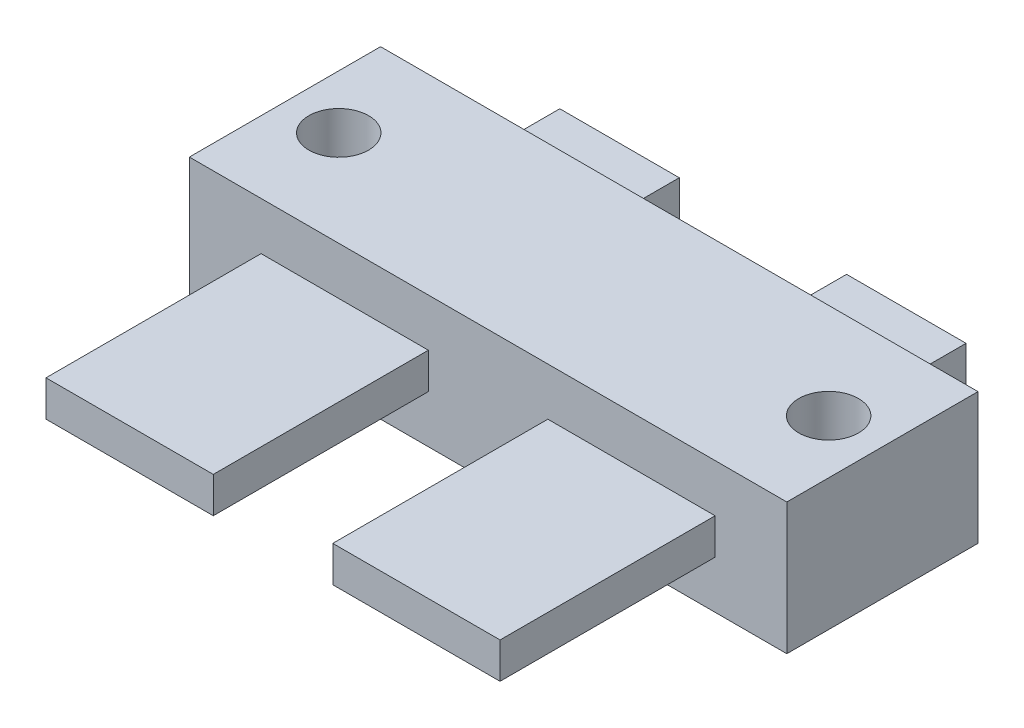
from build123d import *

# Parameters (mm, degrees)
SKETCH_1_W          = 25
SKETCH_1_H          = 8
EXTRUDE_1_DEPTH     = 5.5
SKETCH_3_W          = 7
SKETCH_3_H          = 1.5
EXTRUDE_3_DEPTH     = 9
SKETCH_4_W          = 5
SKETCH_4_H          = 1.5
EXTRUDE_4_DEPTH     = 3.5
SKETCH_5_R          = 1.25
CUT_EXTRUDE_1_DEPTH = 2


with BuildPart() as part:
    # 草图1 → 凸台-拉伸1 (new body)
    with BuildSketch(Plane(origin=(0, 0, 0), x_dir=(1, 0, 0), z_dir=(0, 1, 0))):
        Rectangle(SKETCH_1_W, SKETCH_1_H)
    extrude(amount=EXTRUDE_1_DEPTH)

    # 草图3 → 凸台-拉伸3 (add)
    with BuildSketch(Plane.XY.offset(4)):
        with Locations((-6, 2.75)):
            Rectangle(SKETCH_3_W, SKETCH_3_H)
        with Locations((6, 2.75)):
            Rectangle(SKETCH_3_W, SKETCH_3_H)
    extrude(amount=EXTRUDE_3_DEPTH)

    # 草图4 → 凸台-拉伸4 (add)
    with BuildSketch(Plane(origin=(0, 0, -4), x_dir=(-1, 0, 0), z_dir=(0, 0, -1))):
        with Locations((-6, 2.75)):
            Rectangle(SKETCH_4_W, SKETCH_4_H)
        with Locations((6, 2.75)):
            Rectangle(SKETCH_4_W, SKETCH_4_H)
    extrude(amount=EXTRUDE_4_DEPTH)

    # 草图5 → 切除-拉伸1 (cut)
    with BuildSketch(Plane(origin=(0, 5.5, 0), x_dir=(1, 0, 0), z_dir=(0, 1, 0))):
        with Locations(Location((-10.25, 0, 0), (0, 0, 270))):
            Circle(SKETCH_5_R)
        with Locations(Location((10.25, 0, 0), (0, 0, 90))):
            Circle(SKETCH_5_R)
    extrude(amount=-CUT_EXTRUDE_1_DEPTH, mode=Mode.SUBTRACT)


solid = part.part
